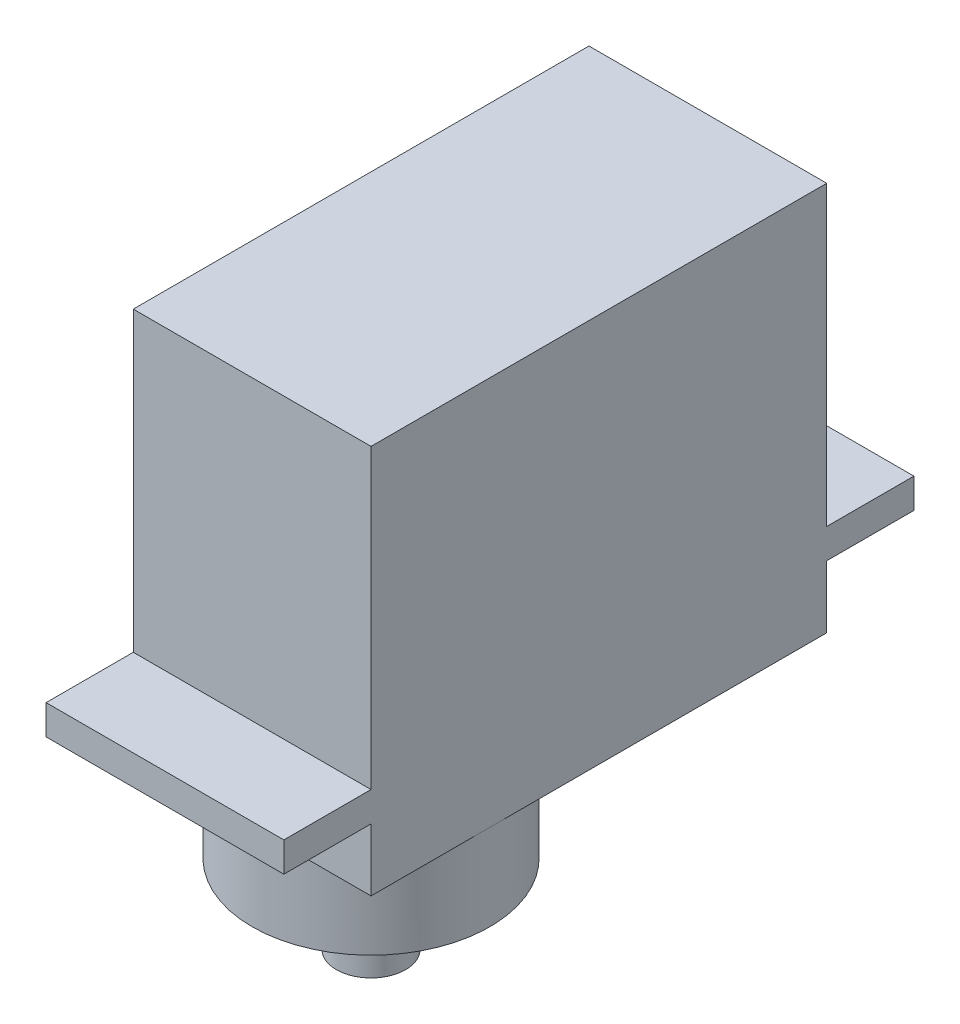
from build123d import *

# Parameters (mm, degrees)
EXTRUDE_1_DEPTH = 12
SKETCH_2_R      = 6
EXTRUDE_2_DEPTH = 4.35
SKETCH_3_R      = 1.75
EXTRUDE_3_DEPTH = 4


with BuildPart() as part:
    # 草图1 → 凸台-拉伸1 (new body)
    with BuildSketch(Plane(origin=(0, 0, 0), x_dir=(0, 0, -1), z_dir=(1, 0, 0))):
        Polygon((0, 0), (0, 15), (23, 15), (23, 0), (27.4, 0), (27.4, -1.5), (23, -1.5), (23, -4.65), (0, -4.65), (0, -1.5), (-4.4, -1.5), (-4.4, 0), align=None)
    extrude(amount=EXTRUDE_1_DEPTH)

    # 草图2 → 凸台-拉伸2 (add)
    with BuildSketch(Plane(origin=(0, -4.65, 0), x_dir=(-1, 0, 0), z_dir=(0, -1, 0))):
        with Locations(Location((-6, 6, 0), (0, 0, 270))):
            Circle(SKETCH_2_R)
    extrude(amount=EXTRUDE_2_DEPTH)

    # 草图3 → 凸台-拉伸3 (add)
    with BuildSketch(Plane.XZ.offset(9)):
        with Locations(Location((6, -6, 0), (0, 0, 270))):
            Circle(SKETCH_3_R)
    extrude(amount=EXTRUDE_3_DEPTH)


solid = part.part
